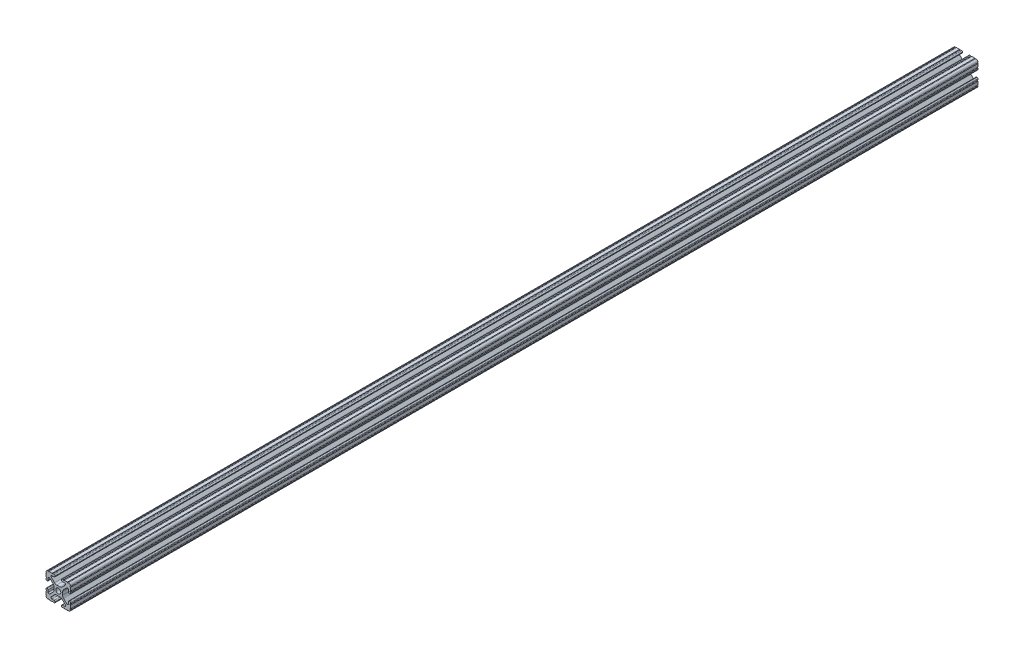
from build123d import *

# Parameters (mm, degrees)
SKETCH1_R           = 2.6035
BOSS_EXTRUDE1_DEPTH = 469.9


with BuildPart() as part:
    # Sketch1 → Boss-Extrude1 (new, symmetric)
    with BuildSketch(Plane.XY):
        with BuildLine():
            Line((-7.179650497, -8.645192506), (-3.952270251, -5.423690499))
            ThreePointArc((-3.952270251, -5.423690499), (-2.922936451, -4.736929036), (-1.709253557, -4.4958))
            Line((-1.709253557, -4.4958), (1.709253557, -4.4958))
            ThreePointArc((1.709253557, -4.4958), (2.922936451, -4.736929036), (3.952270251, -5.423690499))
            Line((3.952270251, -5.423690499), (7.179650497, -8.645192506))
            ThreePointArc((7.179650497, -8.645192506), (7.41473083, -9.822813117), (6.416408329, -10.4902))
            Line((6.416408329, -10.4902), (4.287512407, -10.4902))
            ThreePointArc((4.287512407, -10.4902), (3.54574862, -10.79744862), (3.2385, -11.539212407))
            Line((3.2385, -11.539212407), (3.2385, -11.650987593))
            ThreePointArc((3.2385, -11.650987593), (3.54574862, -12.39275138), (4.287512407, -12.7))
            Line((4.287512407, -12.7), (5.317126718, -12.7))
            ThreePointArc((5.317126718, -12.7), (5.825126718, -12.192), (6.333126718, -12.7))
            Line((6.333126718, -12.7), (9.550443118, -12.7))
            ThreePointArc((9.550443118, -12.7), (10.058366869, -12.192000006), (10.566443095, -12.699847501))
            ThreePointArc((10.566443095, -12.699847501), (12.082537762, -12.08250727), (12.699846982, -10.566399977))
            ThreePointArc((12.699846982, -10.566399977), (12.192000006, -10.058323491), (12.7, -9.5504))
            Line((12.7, -9.5504), (12.7, -6.3330836))
            ThreePointArc((12.7, -6.3330836), (12.192, -5.8250836), (12.7, -5.3170836))
            Line((12.7, -5.3170836), (12.7, -4.287469289))
            ThreePointArc((12.7, -4.287469289), (12.39275138, -3.545705502), (11.650987593, -3.238456882))
            Line((11.650987593, -3.238456882), (11.539212407, -3.238456882))
            ThreePointArc((11.539212407, -3.238456882), (10.79744862, -3.545705502), (10.4902, -4.287469289))
            Line((10.4902, -4.287469289), (10.4902, -6.402089023))
            ThreePointArc((10.4902, -6.402089023), (9.856505071, -7.351067942), (8.737131347, -7.129408934))
            Line((8.737131347, -7.129408934), (5.441005833, -3.840816462))
            ThreePointArc((5.441005833, -3.840816462), (4.750877967, -2.809883091), (4.5085, -1.593185507))
            Line((4.5085, -1.593185507), (4.5085, 1.593185507))
            ThreePointArc((4.5085, 1.593185507), (4.750877967, 2.809883091), (5.441005833, 3.840816462))
            Line((5.441005833, 3.840816462), (8.737131347, 7.129408934))
            ThreePointArc((8.737131347, 7.129408934), (9.856505071, 7.351067942), (10.4902, 6.402089023))
            Line((10.4902, 6.402089023), (10.4902, 4.287469289))
            ThreePointArc((10.4902, 4.287469289), (10.79744862, 3.545705502), (11.539212407, 3.238456882))
            Line((11.539212407, 3.238456882), (11.650987593, 3.238456882))
            ThreePointArc((11.650987593, 3.238456882), (12.39275138, 3.545705502), (12.7, 4.287469289))
            Line((12.7, 4.287469289), (12.7, 5.3170836))
            ThreePointArc((12.7, 5.3170836), (12.192, 5.8250836), (12.7, 6.3330836))
            Line((12.7, 6.3330836), (12.7, 9.5504))
            ThreePointArc((12.7, 9.5504), (12.192000006, 10.058323491), (12.699846982, 10.566399977))
            ThreePointArc((12.699846982, 10.566399977), (12.082537762, 12.08250727), (10.566443095, 12.699847501))
            ThreePointArc((10.566443095, 12.699847501), (10.058366869, 12.192000006), (9.550443118, 12.7))
            Line((9.550443118, 12.7), (6.333126718, 12.7))
            ThreePointArc((6.333126718, 12.7), (5.825126718, 12.192), (5.317126718, 12.7))
            Line((5.317126718, 12.7), (4.287512407, 12.7))
            ThreePointArc((4.287512407, 12.7), (3.54574862, 12.39275138), (3.2385, 11.650987593))
            Line((3.2385, 11.650987593), (3.2385, 11.539212407))
            ThreePointArc((3.2385, 11.539212407), (3.54574862, 10.79744862), (4.287512407, 10.4902))
            Line((4.287512407, 10.4902), (6.476788598, 10.4902))
            ThreePointArc((6.476788598, 10.4902), (7.432222385, 9.85140422), (7.207036008, 8.724370562))
            Line((7.207036008, 8.724370562), (3.898272566, 5.423169045))
            ThreePointArc((3.898272566, 5.423169045), (2.869120213, 4.736787962), (1.655778399, 4.4958))
            Line((1.655778399, 4.4958), (-1.655778399, 4.4958))
            ThreePointArc((-1.655778399, 4.4958), (-2.869120213, 4.736787962), (-3.898272566, 5.423169045))
            Line((-3.898272566, 5.423169045), (-7.207036008, 8.724370562))
            ThreePointArc((-7.207036008, 8.724370562), (-7.432222385, 9.85140422), (-6.476788598, 10.4902))
            Line((-6.476788598, 10.4902), (-4.287512407, 10.4902))
            ThreePointArc((-4.287512407, 10.4902), (-3.54574862, 10.79744862), (-3.2385, 11.539212407))
            Line((-3.2385, 11.539212407), (-3.2385, 11.650987593))
            ThreePointArc((-3.2385, 11.650987593), (-3.54574862, 12.39275138), (-4.287512407, 12.7))
            Line((-4.287512407, 12.7), (-5.317126718, 12.7))
            ThreePointArc((-5.317126718, 12.7), (-5.825126718, 12.192), (-6.333126718, 12.7))
            Line((-6.333126718, 12.7), (-9.550443118, 12.7))
            ThreePointArc((-9.550443118, 12.7), (-10.058366869, 12.192000006), (-10.566443095, 12.699847501))
            ThreePointArc((-10.566443095, 12.699847501), (-12.082537762, 12.08250727), (-12.699846982, 10.566399977))
            ThreePointArc((-12.699846982, 10.566399977), (-12.192000006, 10.058323491), (-12.7, 9.5504))
            Line((-12.7, 9.5504), (-12.7, 6.3330836))
            ThreePointArc((-12.7, 6.3330836), (-12.192, 5.8250836), (-12.7, 5.3170836))
            Line((-12.7, 5.3170836), (-12.7, 4.287469289))
            ThreePointArc((-12.7, 4.287469289), (-12.39275138, 3.545705502), (-11.650987593, 3.238456882))
            Line((-11.650987593, 3.238456882), (-11.539212407, 3.238456882))
            ThreePointArc((-11.539212407, 3.238456882), (-10.79744862, 3.545705502), (-10.4902, 4.287469289))
            Line((-10.4902, 4.287469289), (-10.4902, 6.402089023))
            ThreePointArc((-10.4902, 6.402089023), (-9.856505071, 7.351067942), (-8.737131347, 7.129408934))
            Line((-8.737131347, 7.129408934), (-5.441005833, 3.840816462))
            ThreePointArc((-5.441005833, 3.840816462), (-4.750877967, 2.809883091), (-4.5085, 1.593185507))
            Line((-4.5085, 1.593185507), (-4.5085, -1.593185507))
            ThreePointArc((-4.5085, -1.593185507), (-4.750877967, -2.809883091), (-5.441005833, -3.840816462))
            Line((-5.441005833, -3.840816462), (-8.737131347, -7.129408934))
            ThreePointArc((-8.737131347, -7.129408934), (-9.856505071, -7.351067942), (-10.4902, -6.402089023))
            Line((-10.4902, -6.402089023), (-10.4902, -4.287469289))
            ThreePointArc((-10.4902, -4.287469289), (-10.79744862, -3.545705502), (-11.539212407, -3.238456882))
            Line((-11.539212407, -3.238456882), (-11.650987593, -3.238456882))
            ThreePointArc((-11.650987593, -3.238456882), (-12.39275138, -3.545705502), (-12.7, -4.287469289))
            Line((-12.7, -4.287469289), (-12.7, -5.3170836))
            ThreePointArc((-12.7, -5.3170836), (-12.192, -5.8250836), (-12.7, -6.3330836))
            Line((-12.7, -6.3330836), (-12.7, -9.5504))
            ThreePointArc((-12.7, -9.5504), (-12.192000006, -10.058323491), (-12.699846982, -10.566399977))
            ThreePointArc((-12.699846982, -10.566399977), (-12.082537762, -12.08250727), (-10.566443095, -12.699847501))
            ThreePointArc((-10.566443095, -12.699847501), (-10.058366869, -12.192000006), (-9.550443118, -12.7))
            Line((-9.550443118, -12.7), (-6.333126718, -12.7))
            ThreePointArc((-6.333126718, -12.7), (-5.825126718, -12.192), (-5.317126718, -12.7))
            Line((-5.317126718, -12.7), (-4.287512407, -12.7))
            ThreePointArc((-4.287512407, -12.7), (-3.54574862, -12.39275138), (-3.2385, -11.650987593))
            Line((-3.2385, -11.650987593), (-3.2385, -11.539212407))
            ThreePointArc((-3.2385, -11.539212407), (-3.54574862, -10.79744862), (-4.287512407, -10.4902))
            Line((-4.287512407, -10.4902), (-6.416408329, -10.4902))
            ThreePointArc((-6.416408329, -10.4902), (-7.41473083, -9.822813117), (-7.179650497, -8.645192506))
        make_face()
        Circle(SKETCH1_R, mode=Mode.SUBTRACT)
    extrude(amount=BOSS_EXTRUDE1_DEPTH, both=True)


solid = part.part
